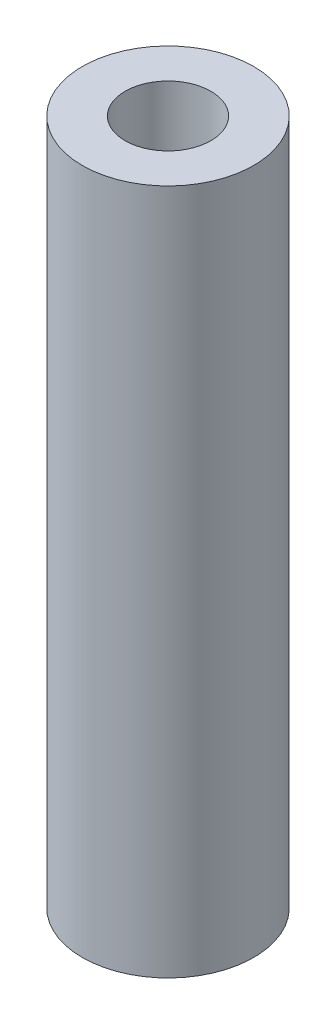
from build123d import *

# Parameters (mm, degrees)
SKETCH_1_R      = 3
SKETCH_1_R_2    = 1.5
EXTRUDE_1_DEPTH = 24


with BuildPart() as part:
    # 草图1 → 凸台-拉伸1 (new body)
    with BuildSketch(Plane(origin=(0, 0, 0), x_dir=(1, 0, 0), z_dir=(0, 1, 0))):
        with Locations(Location((0, 0, 0), (0, 0, 270))):
            Circle(SKETCH_1_R)
        with Locations(Location((0, 0, 0), (0, 0, 270))):
            Circle(SKETCH_1_R_2, mode=Mode.SUBTRACT)
    extrude(amount=EXTRUDE_1_DEPTH)


solid = part.part
